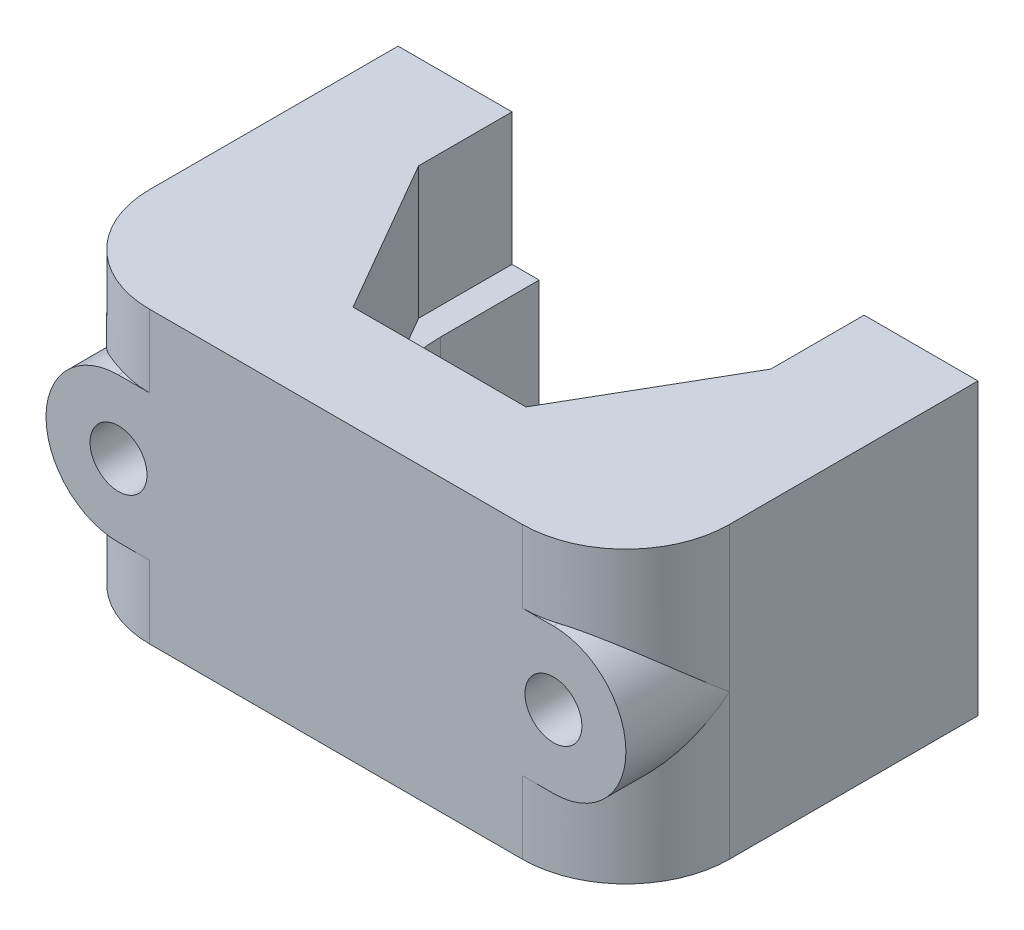
from build123d import *

# Parameters (mm, degrees)
SKETCH1_W           = 56
SKETCH1_H           = 34
BOSS_EXTRUDE1_DEPTH = 28
CUT_EXTRUDE1_DEPTH  = 12.75
CUT_EXTRUDE2_DEPTH  = 15.25
FILLET1_R           = 10
BOSS_EXTRUDE2_DEPTH = 10
SKETCH6_R           = 2.75
CUT_EXTRUDE3_DEPTH  = 34


with BuildPart() as part:
    # Sketch1 → Boss-Extrude1 (new body)
    with BuildSketch(Plane(origin=(0, 0, 0), x_dir=(1, 0, 0), z_dir=(0, 1, 0))):
        Rectangle(SKETCH1_W, SKETCH1_H)
    extrude(amount=BOSS_EXTRUDE1_DEPTH)

    # Sketch2 → Cut-Extrude1 (cut)
    with BuildSketch(Plane(origin=(0, 28, 0), x_dir=(1, 0, 0), z_dir=(0, 1, 0))):
        Polygon((-17, 7.982239485), (-8.35, -7), (8.35, -7), (17, 7.982239485), (17, 17), (-17, 17), align=None)
    extrude(amount=-CUT_EXTRUDE1_DEPTH, mode=Mode.SUBTRACT)

    # Sketch3 → Cut-Extrude2 (cut)
    with BuildSketch(Plane(origin=(0, 15.25, 0), x_dir=(1, 0, 0), z_dir=(0, 1, 0))):
        with BuildLine():
            Line((-14.375, 7.462624243), (-14.375, 17))
            Line((-14.375, 17), (14.375, 17))
            Line((14.375, 17), (14.375, 7.462624243))
            ThreePointArc((14.375, 7.462624243), (0, -6.912375757), (-14.375, 7.462624243))
        make_face()
    extrude(amount=-CUT_EXTRUDE2_DEPTH, mode=Mode.SUBTRACT)

    # Fillet1
    fillet1_edges = [part.edges().sort_by_distance(p)[0] for p in [
        (28, 14, 17),
        (-28, 14, 17),
    ]]
    fillet(fillet1_edges, radius=FILLET1_R)

    # Sketch5 → Boss-Extrude2 (add)
    with BuildSketch(Plane(origin=(0, 0, 7), x_dir=(-1, 0, 0), z_dir=(0, 0, -1))):
        with BuildLine():
            Line((18, 21), (18, 7))
            Line((18, 7), (21, 7))
            ThreePointArc((21, 7), (28, 14), (21, 21))
            Line((21, 21), (18, 21))
        make_face()
        with BuildLine():
            Line((-18, 7), (-21, 7))
            ThreePointArc((-21, 7), (-28, 14), (-21, 21))
            Line((-21, 21), (-18, 21))
            Line((-18, 21), (-18, 7))
        make_face()
    extrude(amount=-BOSS_EXTRUDE2_DEPTH)

    # Sketch6 → Cut-Extrude3 (cut)
    with BuildSketch(Plane.XY.offset(17)):
        with Locations((-21, 14)):
            Circle(SKETCH6_R)
        with Locations((21, 14)):
            Circle(SKETCH6_R)
    extrude(amount=-CUT_EXTRUDE3_DEPTH, mode=Mode.SUBTRACT)


solid = part.part
